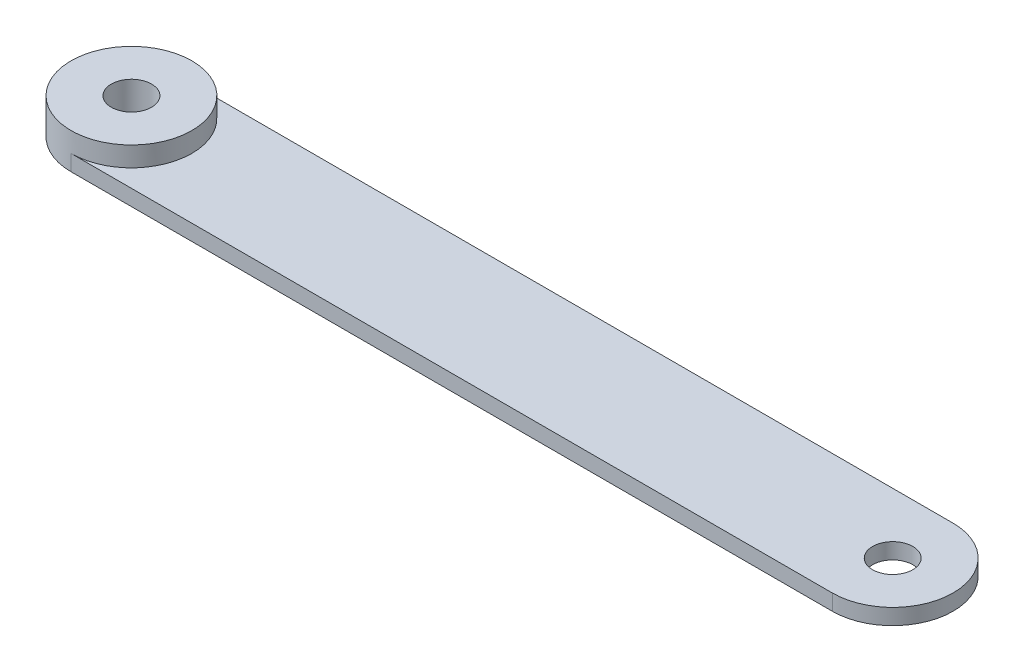
from build123d import *
from build123d.topology import SkipClean

# Parameters (mm, degrees)
SKETCH2_R               = 8.0645
BOSS_EXTRUDE2_DEPTH     = 3.175
SKETCH3_R               = 24.1935
SKETCH3_R_2             = 8.0645
BOSS_EXTRUDE3_DEPTH     = 7.9375
CUT_EXTRUDE2_DEPTH      = 181.356612
CUT_EXTRUDE2_DEPTH_BACK = 181.356612


with BuildPart() as part:
    # Sketch2 → Boss-Extrude2 (new, symmetric)
    with BuildSketch(Plane(origin=(0, 0, 0), x_dir=(1, 0, 0), z_dir=(0, 1, 0))):
        with BuildLine():
            ThreePointArc((155.79044, -23.954757), (176.5935, 0), (155.79044, 23.954757))
            ThreePointArc((155.79044, 23.954757), (0, 34.925), (-155.79044, 23.954757))
            ThreePointArc((-155.79044, 23.954757), (-176.5935, 0), (-155.79044, -23.954757))
            ThreePointArc((-155.79044, -23.954757), (0, -34.925), (155.79044, -23.954757))
        make_face()
        with Locations((-152.4, 0)):
            Circle(SKETCH2_R, mode=Mode.SUBTRACT)
        with Locations((152.4, 0)):
            Circle(SKETCH2_R, mode=Mode.SUBTRACT)
    extrude(amount=BOSS_EXTRUDE2_DEPTH, both=True)

    # Sketch3 → Boss-Extrude3 (add)
    with SkipClean():  # the faces are left unmerged after this step: merging them gives an invalid solid
        with BuildSketch(Plane.XZ.offset(-3.175)):
            with Locations((-152.4, 0)):
                Circle(SKETCH3_R)
            with Locations((-152.4, 0)):
                Circle(SKETCH3_R_2, mode=Mode.SUBTRACT)
        extrude(amount=-BOSS_EXTRUDE3_DEPTH)

    # Sketch2<3> → Cut-Extrude2 (cut, two sides: drawn at the far end of the back side and taken through both)
    with BuildSketch(Plane(origin=(0, 0, 0), x_dir=(1, 0, 0), z_dir=(0, 1, 0)).offset(-CUT_EXTRUDE2_DEPTH_BACK)):
        with BuildLine():
            Line((-152.4, 24.1935), (152.4, 24.1935))
            ThreePointArc((152.4, 24.1935), (154.099418, 24.13374), (155.79044, 23.954757))
            ThreePointArc((155.79044, 23.954757), (0, 34.925), (-155.79044, 23.954757))
            ThreePointArc((-155.79044, 23.954757), (-154.099418, 24.13374), (-152.4, 24.1935))
        make_face()
        with BuildLine():
            ThreePointArc((-155.79044, -23.954757), (0, -34.925), (155.79044, -23.954757))
            ThreePointArc((155.79044, -23.954757), (154.099418, -24.13374), (152.4, -24.1935))
            Line((152.4, -24.1935), (-152.4, -24.1935))
            ThreePointArc((-152.4, -24.1935), (-154.099418, -24.13374), (-155.79044, -23.954757))
        make_face()
    extrude(amount=CUT_EXTRUDE2_DEPTH + CUT_EXTRUDE2_DEPTH_BACK, mode=Mode.SUBTRACT)


solid = part.part
